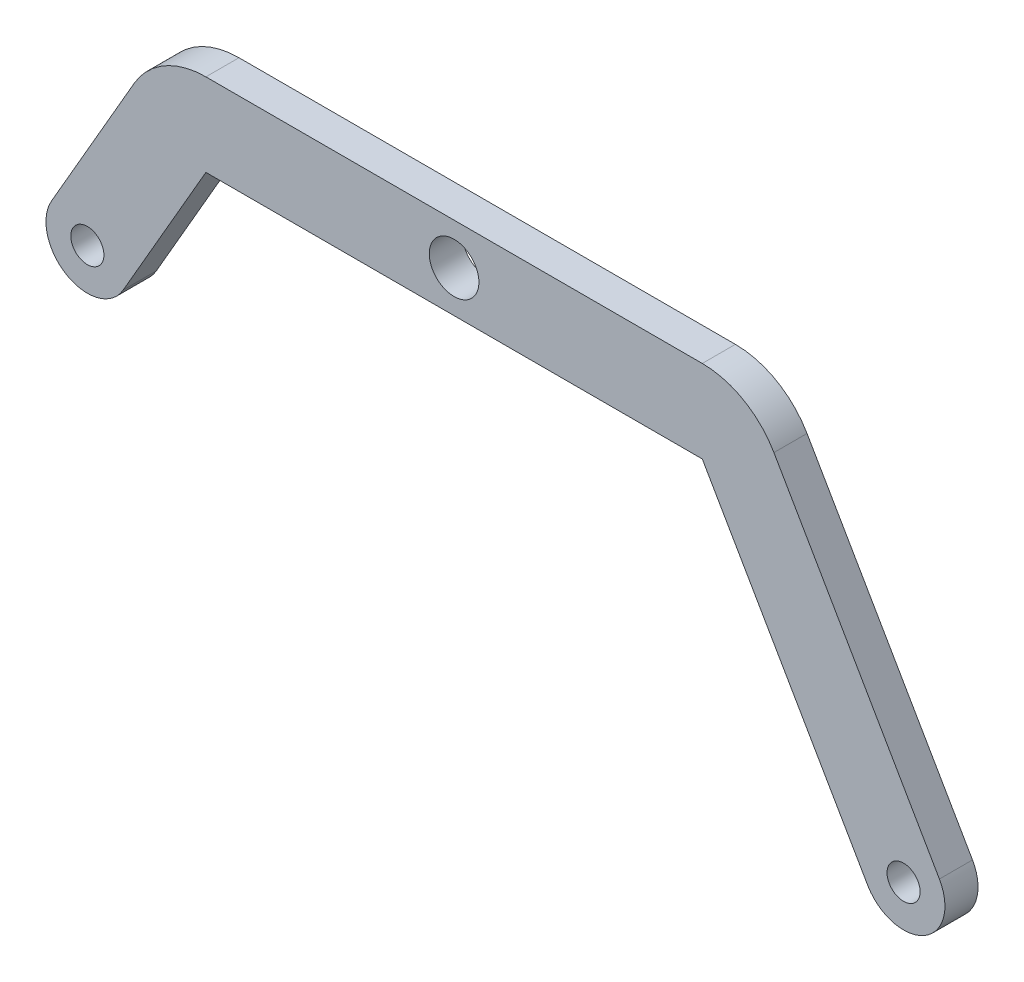
from build123d import *

# Parameters (mm, degrees)
SKETCH1_R           = 7.5
SKETCH1_R_2         = 5
BOSS_EXTRUDE1_DEPTH = 5


with BuildPart() as part:
    # Sketch1 → Boss-Extrude1 (new, symmetric)
    with BuildSketch(Plane.XY):
        with BuildLine():
            Line((-75, -12.5), (75, -12.5))
            Line((75, -12.5), (125, -99.102540378))
            ThreePointArc((125, -99.102540378), (142.075317547, -103.677857926), (146.650635095, -86.602540378))
            Line((146.650635095, -86.602540378), (96.650635095, 0))
            ThreePointArc((96.650635095, 0), (87.5, 9.150635095), (75, 12.5))
            Line((75, 12.5), (-75, 12.5))
            ThreePointArc((-75, 12.5), (-87.5, 9.150635095), (-96.650635095, 0))
            Line((-96.650635095, 0), (-121.650635095, -43.301270189))
            ThreePointArc((-121.650635095, -43.301270189), (-117.075317547, -60.376587737), (-100, -55.801270189))
            Line((-100, -55.801270189), (-75, -12.5))
        make_face()
        Circle(SKETCH1_R, mode=Mode.SUBTRACT)
        with Locations((135.825317547, -92.852540378)):
            Circle(SKETCH1_R_2, mode=Mode.SUBTRACT)
        with Locations((-110.825317547, -49.551270189)):
            Circle(SKETCH1_R_2, mode=Mode.SUBTRACT)
    extrude(amount=BOSS_EXTRUDE1_DEPTH, both=True)


solid = part.part
